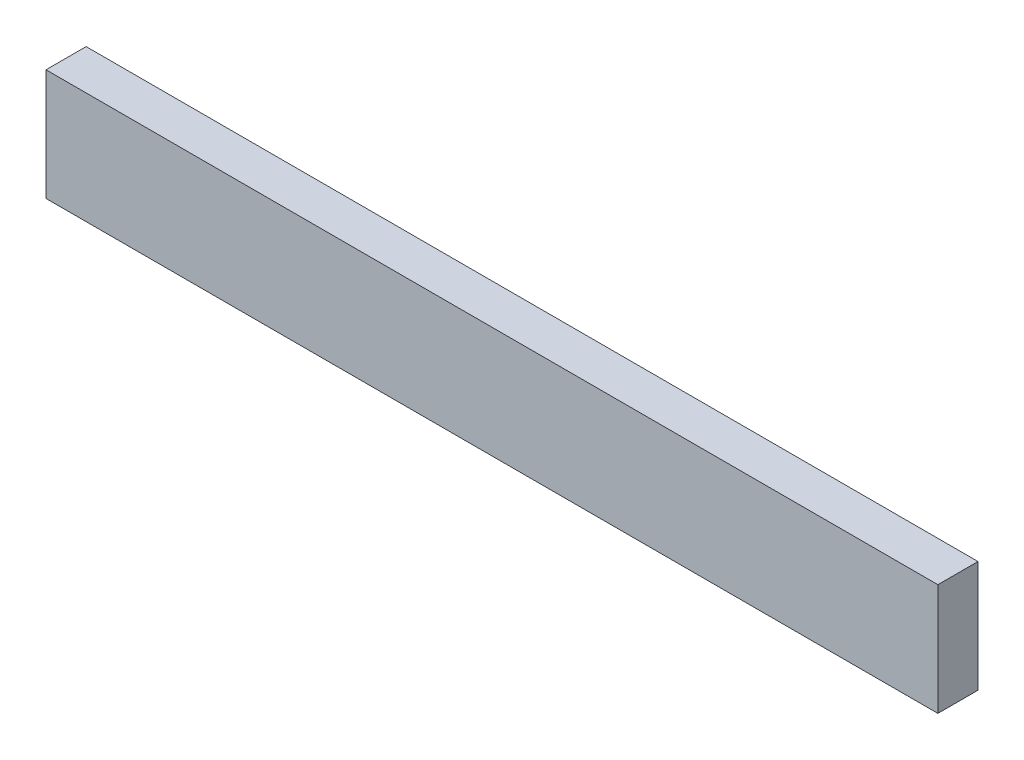
from build123d import *

# Parameters (mm, degrees)
SKETCH2_W           = 400
SKETCH2_H           = 50
BOSS_EXTRUDE1_DEPTH = 18


with BuildPart() as part:
    # Sketch2 → Boss-Extrude1 (new body)
    with BuildSketch(Plane.XY):
        with Locations((200, 25)):
            Rectangle(SKETCH2_W, SKETCH2_H)
    extrude(amount=BOSS_EXTRUDE1_DEPTH)


solid = part.part
